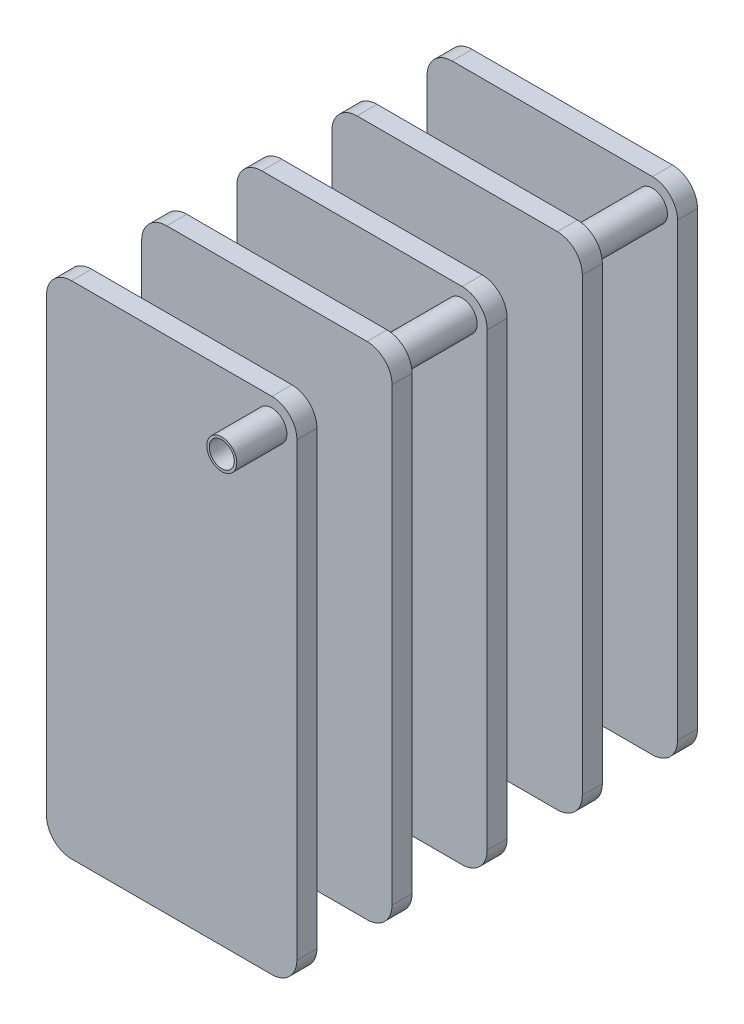
from build123d import *

# Parameters (mm, degrees)
SKETCH_1_W       = 50
SKETCH_1_H       = 100
EXTRUDE_1_DEPTH  = 4
FILLET_2_R       = 5
FILLET_3_R       = 5
FILLET_4_R       = 5
FILLET_5_R       = 5
SKETCH_2_R       = 3
EXTRUDE_2_DEPTH  = 10
SKETCH_3_R       = 3
EXTRUDE_3_DEPTH  = 15
SKETCH_6_W       = 50
SKETCH_6_H       = 100
EXTRUDE_4_DEPTH  = 4
FILLET_6_R       = 5
FILLET_7_R       = 5
FILLET_8_R       = 5
FILLET_9_R       = 5
SKETCH_7_W       = 50
SKETCH_7_H       = 100
EXTRUDE_5_DEPTH  = 4
EXTRUDE_START    = 15
SKETCH_8_R       = 3
EXTRUDE_6_DEPTH  = 15
SKETCH_9_W       = 50
SKETCH_9_H       = 100
EXTRUDE_7_DEPTH  = 4
SKETCH_11_R      = 3
EXTRUDE_9_DEPTH  = 15
FILLET_10_R      = 5
FILLET_11_R      = 5
FILLET_12_R      = 5
FILLET_13_R      = 5
FILLET_14_R      = 5
FILLET_15_R      = 5
FILLET_16_R      = 5
FILLET_17_R      = 5
SKETCH_13_W      = 50
SKETCH_13_H      = 100
EXTRUDE_10_DEPTH = 4
SKETCH_14_R      = 3
EXTRUDE_11_DEPTH = 15
FILLET_18_R      = 5
FILLET_19_R      = 5
FILLET_20_R      = 5
FILLET_21_R      = 5
SKETCH_15_R      = 3
EXTRUDE_12_DEPTH = 10
SHELL_1_T        = -0.5


with BuildPart() as part:
    # 草图1 → 凸台-拉伸1 (new body)
    with BuildSketch(Plane.XY):
        Rectangle(SKETCH_1_W, SKETCH_1_H)
    extrude(amount=EXTRUDE_1_DEPTH)

    # 圆角2
    fillet_2_edges = [part.edges().sort_by_distance(p)[0] for p in [
        (25, 50, 2),
    ]]
    fillet(fillet_2_edges, radius=FILLET_2_R)

    # 圆角3
    fillet_3_edges = [part.edges().sort_by_distance(p)[0] for p in [
        (-25, 50, 2),
    ]]
    fillet(fillet_3_edges, radius=FILLET_3_R)

    # 圆角4
    fillet_4_edges = [part.edges().sort_by_distance(p)[0] for p in [
        (25, -50, 2),
    ]]
    fillet(fillet_4_edges, radius=FILLET_4_R)

    # 圆角5
    fillet_5_edges = [part.edges().sort_by_distance(p)[0] for p in [
        (-25, -50, 2),
    ]]
    fillet(fillet_5_edges, radius=FILLET_5_R)

    # 草图2 → 凸台-拉伸2 (add)
    with BuildSketch(Plane.XY.offset(4)):
        with Locations((20, 45)):
            Circle(SKETCH_2_R)
    extrude(amount=EXTRUDE_2_DEPTH)

    # 草图3 → 凸台-拉伸3 (add)
    with BuildSketch(Plane(origin=(0, 0, 0), x_dir=(-1, 0, 0), z_dir=(0, 0, -1))):
        with Locations(Location((20, -45, 0), (0, 0, 180))):
            Circle(SKETCH_3_R)
    extrude(amount=EXTRUDE_3_DEPTH)

    # 草图6 → 凸台-拉伸4 (add)
    with BuildSketch(Plane(origin=(0, 0, -15), x_dir=(-1, 0, 0), z_dir=(0, 0, -1))):
        Rectangle(SKETCH_6_W, SKETCH_6_H)
    extrude(amount=EXTRUDE_4_DEPTH)

    # 圆角6
    fillet_6_edges = [part.edges().sort_by_distance(p)[0] for p in [
        (25, 50, -17),
    ]]
    fillet(fillet_6_edges, radius=FILLET_6_R)

    # 圆角7
    fillet_7_edges = [part.edges().sort_by_distance(p)[0] for p in [
        (-25, 50, -17),
    ]]
    fillet(fillet_7_edges, radius=FILLET_7_R)

    # 圆角8
    fillet_8_edges = [part.edges().sort_by_distance(p)[0] for p in [
        (-25, -50, -17),
    ]]
    fillet(fillet_8_edges, radius=FILLET_8_R)

    # 圆角9
    fillet_9_edges = [part.edges().sort_by_distance(p)[0] for p in [
        (25, -50, -17),
    ]]
    fillet(fillet_9_edges, radius=FILLET_9_R)



with BuildPart() as body_2:
    # 草图7 → 凸台-拉伸5 (new body)
    with BuildSketch(Plane(origin=(0, 0, -34), x_dir=(-1, 0, 0), z_dir=(0, 0, -1))):
        Rectangle(SKETCH_7_W, SKETCH_7_H)
    extrude(amount=EXTRUDE_5_DEPTH)


with BuildPart() as part_1:
    add(part.part)

    add(body_2.part)  # 凸台-拉伸6 merges body 2
    # 草图8 → 凸台-拉伸6 (add)
    with BuildSketch(Plane(origin=(0, 0, -19), x_dir=(-1, 0, 0), z_dir=(0, 0, -1)).offset(EXTRUDE_START)):
        with Locations(Location((-20, 45, 0), (0, 0, 180))):
            Circle(SKETCH_8_R)
    extrude(amount=-EXTRUDE_6_DEPTH)



with BuildPart() as body_2_2:
    # 草图9 → 凸台-拉伸7 (new body)
    with BuildSketch(Plane(origin=(0, 0, -53), x_dir=(-1, 0, 0), z_dir=(0, 0, -1))):
        Rectangle(SKETCH_9_W, SKETCH_9_H)
    extrude(amount=EXTRUDE_7_DEPTH)


with BuildPart() as part_2:
    add(part_1.part)

    add(body_2_2.part)  # 凸台-拉伸9 merges body 2 2
    # 草图11 → 凸台-拉伸9 (add)
    with BuildSketch(Plane(origin=(0, 0, -38), x_dir=(-1, 0, 0), z_dir=(0, 0, -1))):
        with Locations(Location((20, -45, 0), (0, 0, 180))):
            Circle(SKETCH_11_R)
    extrude(amount=EXTRUDE_9_DEPTH)

    # 圆角10
    fillet_10_edges = [part_2.edges().sort_by_distance(p)[0] for p in [
        (25, 50, -36),
    ]]
    fillet(fillet_10_edges, radius=FILLET_10_R)

    # 圆角11
    fillet_11_edges = [part_2.edges().sort_by_distance(p)[0] for p in [
        (25, 50, -55),
    ]]
    fillet(fillet_11_edges, radius=FILLET_11_R)

    # 圆角12
    fillet_12_edges = [part_2.edges().sort_by_distance(p)[0] for p in [
        (-25, 50, -55),
    ]]
    fillet(fillet_12_edges, radius=FILLET_12_R)

    # 圆角13
    fillet_13_edges = [part_2.edges().sort_by_distance(p)[0] for p in [
        (-25, 50, -36),
    ]]
    fillet(fillet_13_edges, radius=FILLET_13_R)

    # 圆角14
    fillet_14_edges = [part_2.edges().sort_by_distance(p)[0] for p in [
        (-25, -50, -55),
    ]]
    fillet(fillet_14_edges, radius=FILLET_14_R)

    # 圆角15
    fillet_15_edges = [part_2.edges().sort_by_distance(p)[0] for p in [
        (-25, -50, -36),
    ]]
    fillet(fillet_15_edges, radius=FILLET_15_R)

    # 圆角16
    fillet_16_edges = [part_2.edges().sort_by_distance(p)[0] for p in [
        (25, -50, -55),
    ]]
    fillet(fillet_16_edges, radius=FILLET_16_R)

    # 圆角17
    fillet_17_edges = [part_2.edges().sort_by_distance(p)[0] for p in [
        (25, -50, -36),
    ]]
    fillet(fillet_17_edges, radius=FILLET_17_R)



with BuildPart() as body_2_3:
    # 草图13 → 凸台-拉伸10 (new body)
    with BuildSketch(Plane(origin=(0, 0, -72), x_dir=(-1, 0, 0), z_dir=(0, 0, -1))):
        Rectangle(SKETCH_13_W, SKETCH_13_H)
    extrude(amount=EXTRUDE_10_DEPTH)


with BuildPart() as part_3:
    add(part_2.part)

    add(body_2_3.part)  # 凸台-拉伸11 merges body 2 3
    # 草图14 → 凸台-拉伸11 (add)
    with BuildSketch(Plane(origin=(0, 0, -57), x_dir=(-1, 0, 0), z_dir=(0, 0, -1)).offset(EXTRUDE_START)):
        with Locations(Location((-20, 45, 0), (0, 0, 180))):
            Circle(SKETCH_14_R)
    extrude(amount=-EXTRUDE_11_DEPTH)

    # 圆角18
    fillet_18_edges = [part_3.edges().sort_by_distance(p)[0] for p in [
        (25, 50, -74),
    ]]
    fillet(fillet_18_edges, radius=FILLET_18_R)

    # 圆角19
    fillet_19_edges = [part_3.edges().sort_by_distance(p)[0] for p in [
        (-25, 50, -74),
    ]]
    fillet(fillet_19_edges, radius=FILLET_19_R)

    # 圆角20
    fillet_20_edges = [part_3.edges().sort_by_distance(p)[0] for p in [
        (25, -50, -74),
    ]]
    fillet(fillet_20_edges, radius=FILLET_20_R)

    # 圆角21
    fillet_21_edges = [part_3.edges().sort_by_distance(p)[0] for p in [
        (-25, -50, -74),
    ]]
    fillet(fillet_21_edges, radius=FILLET_21_R)

    # 草图15 → 凸台-拉伸12 (add)
    with BuildSketch(Plane(origin=(0, 0, -76), x_dir=(-1, 0, 0), z_dir=(0, 0, -1))):
        with Locations(Location((20, -45, 0), (0, 0, 180))):
            Circle(SKETCH_15_R)
    extrude(amount=EXTRUDE_12_DEPTH)

    # 抽壳1
    shell_1_openings = [part_3.faces().sort_by_distance(p)[0] for p in [
        (-20, -45, -86),
        (20, 45, 14),
    ]]
    offset(amount=SHELL_1_T, openings=shell_1_openings, kind=Kind.INTERSECTION)


solid = part_3.part
